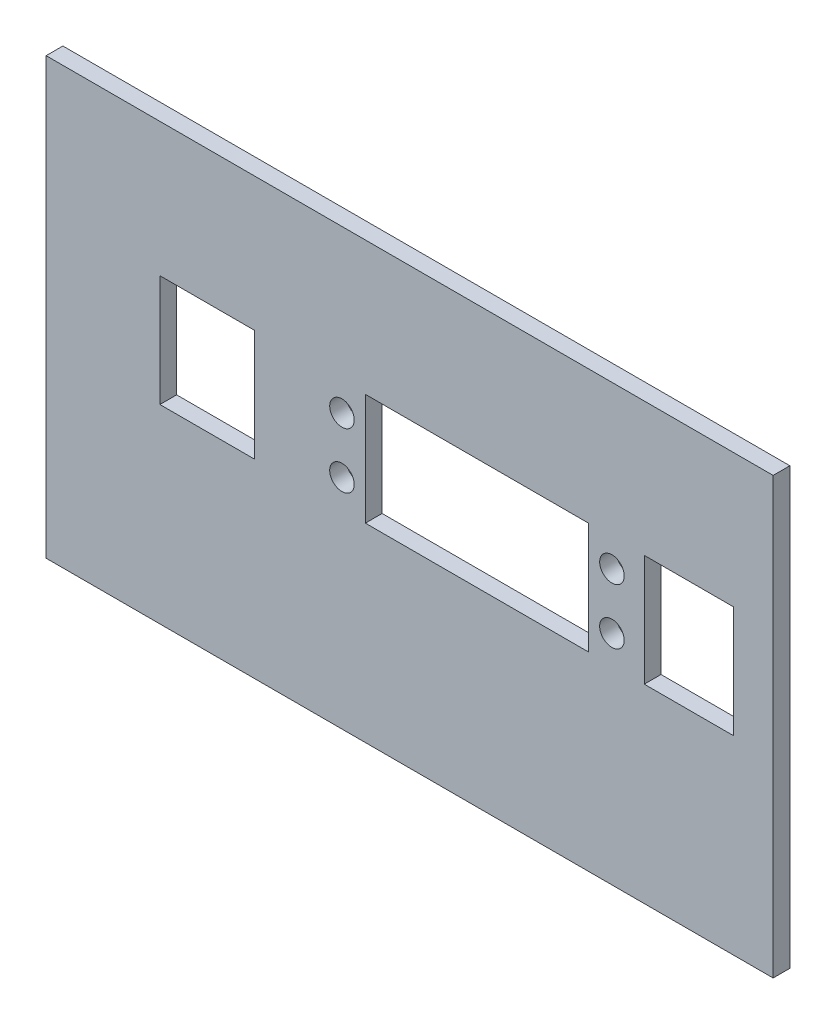
from build123d import *

# Parameters (mm, degrees)
SKETCH_1_W          = 130.339859815
SKETCH_1_H          = 78.03787785
SKETCH_1_R          = 2.2
SKETCH_1_W_2        = 40
SKETCH_1_H_2        = 20
SKETCH_1_W_3        = 17
SKETCH_1_H_3        = 20.000000003
SKETCH_1_W_4        = 16
EXTRUDE_1_DEPTH     = 1.5
SKETCH_2_W          = 120
SKETCH_2_H          = 3
EXTRUDE_2_DEPTH     = 9
SKETCH_3_R          = 2
CUT_EXTRUDE_1_DEPTH = 6


with BuildPart() as part:
    # 草图1 → 凸台-拉伸1 (new, symmetric)
    with BuildSketch(Plane.XY):
        with Locations((26.773633624, -6.330200198)):
            Rectangle(SKETCH_1_W, SKETCH_1_H)
        with Locations((14.641461985, 3.722155933)):
            Circle(SKETCH_1_R, mode=Mode.SUBTRACT)
        with Locations((14.641461985, -6.277844067)):
            Circle(SKETCH_1_R, mode=Mode.SUBTRACT)
        with Locations((63.041461985, 3.722155933)):
            Circle(SKETCH_1_R, mode=Mode.SUBTRACT)
        with Locations((63.041461985, -6.277844067)):
            Circle(SKETCH_1_R, mode=Mode.SUBTRACT)
        with Locations((38.841461985, -1.277844067)):
            Rectangle(SKETCH_1_W_2, SKETCH_1_H_2, mode=Mode.SUBTRACT)
        with Locations((-9.499534143, -1.277844069)):
            Rectangle(SKETCH_1_W_3, SKETCH_1_H_3, mode=Mode.SUBTRACT)
        with Locations((76.841461985, -1.277844067)):
            Rectangle(SKETCH_1_W_4, SKETCH_1_H_2, mode=Mode.SUBTRACT)
    extrude(amount=EXTRUDE_1_DEPTH, both=True)

    # 草图2 → 凸台-拉伸2 (add)
    with BuildSketch(Plane.XY.offset(1.5)):
        with Locations((21.603703717, -43.849139123)):
            Rectangle(SKETCH_2_W, SKETCH_2_H)
    extrude(amount=-EXTRUDE_2_DEPTH)

    # 草图3 → 切除-拉伸1 (cut)
    with BuildSketch(Plane(origin=(0, -42.349139123, 0), x_dir=(1, 0, 0), z_dir=(0, 1, 0))):
        with Locations(Location((-31.396296283, 4.5, 0), (0, 0, 180))):
            Circle(SKETCH_3_R)
        with Locations(Location((74.603703717, 4.5, 0), (0, 0, 180))):
            Circle(SKETCH_3_R)
    extrude(amount=-CUT_EXTRUDE_1_DEPTH, mode=Mode.SUBTRACT)


solid = part.part
